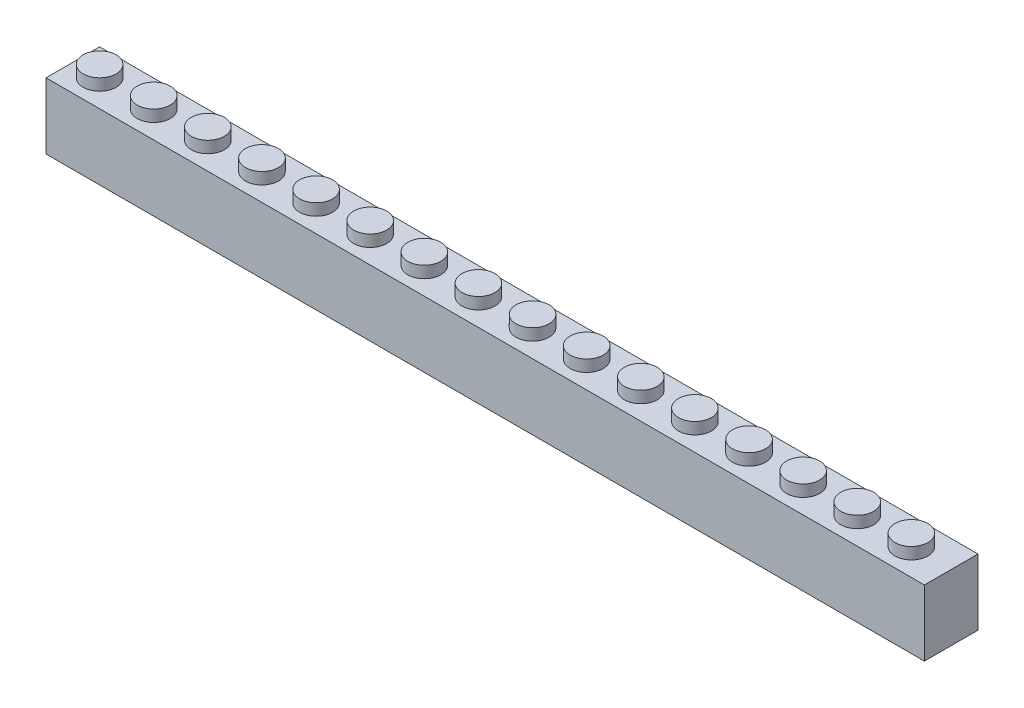
from build123d import *

# Parameters (mm, degrees)
SKETCH_1_W          = 127.8
SKETCH_1_H          = 7.8
EXTRUDE_1_DEPTH     = 9.6
SKETCH_2_R          = 2.4
EXTRUDE_2_DEPTH     = 1.7
SKETCH_3_R          = 2.5
CUT_EXTRUDE_2_DEPTH = 1.8


with BuildPart() as part:
    # Эскиз1 → Бобышка-Вытянуть1 (new body)
    with BuildSketch(Plane(origin=(0, 0, 0), x_dir=(1, 0, 0), z_dir=(0, 1, 0))):
        Rectangle(SKETCH_1_W, SKETCH_1_H)
    extrude(amount=EXTRUDE_1_DEPTH)

    # Эскиз2 → Бобышка-Вытянуть2 (add)
    with BuildSketch(Plane(origin=(0, 9.6, 0), x_dir=(1, 0, 0), z_dir=(0, 1, 0))):
        with Locations(Location((-60, 0, 0), (0, 0, 90))):
            Circle(SKETCH_2_R)
        with Locations(Location((-52.126, 0, 0), (0, 0, 90))):
            Circle(SKETCH_2_R)
        with Locations(Location((-44.252, 0, 0), (0, 0, 90))):
            Circle(SKETCH_2_R)
        with Locations(Location((-36.378, 0, 0), (0, 0, 90))):
            Circle(SKETCH_2_R)
        with Locations(Location((-28.504, 0, 0), (0, 0, 90))):
            Circle(SKETCH_2_R)
        with Locations(Location((-20.63, 0, 0), (0, 0, 90))):
            Circle(SKETCH_2_R)
        with Locations(Location((-12.756, 0, 0), (0, 0, 90))):
            Circle(SKETCH_2_R)
        with Locations(Location((-4.882, 0, 0), (0, 0, 90))):
            Circle(SKETCH_2_R)
        with Locations(Location((2.992, 0, 0), (0, 0, 90))):
            Circle(SKETCH_2_R)
        with Locations(Location((10.866, 0, 0), (0, 0, 90))):
            Circle(SKETCH_2_R)
        with Locations(Location((18.74, 0, 0), (0, 0, 90))):
            Circle(SKETCH_2_R)
        with Locations(Location((26.614, 0, 0), (0, 0, 90))):
            Circle(SKETCH_2_R)
        with Locations(Location((34.488, 0, 0), (0, 0, 90))):
            Circle(SKETCH_2_R)
        with Locations(Location((42.362, 0, 0), (0, 0, 90))):
            Circle(SKETCH_2_R)
        with Locations(Location((50.236, 0, 0), (0, 0, 90))):
            Circle(SKETCH_2_R)
        with Locations(Location((58.11, 0, 0), (0, 0, 90))):
            Circle(SKETCH_2_R)
    extrude(amount=EXTRUDE_2_DEPTH)

    # Эскиз3 → Вырез-Вытянуть2 (cut)
    with BuildSketch(Plane.XZ):
        with Locations(Location((-60, 0, 0), (0, 0, 270))):
            Circle(SKETCH_3_R)
        with Locations(Location((-52.126, 0, 0), (0, 0, 270))):
            Circle(SKETCH_3_R)
        with Locations(Location((-44.252, 0, 0), (0, 0, 270))):
            Circle(SKETCH_3_R)
        with Locations(Location((-36.378, 0, 0), (0, 0, 270))):
            Circle(SKETCH_3_R)
        with Locations(Location((-28.504, 0, 0), (0, 0, 270))):
            Circle(SKETCH_3_R)
        with Locations(Location((-20.63, 0, 0), (0, 0, 270))):
            Circle(SKETCH_3_R)
        with Locations(Location((-12.756, 0, 0), (0, 0, 270))):
            Circle(SKETCH_3_R)
        with Locations(Location((-4.882, 0, 0), (0, 0, 270))):
            Circle(SKETCH_3_R)
        with Locations(Location((2.992, 0, 0), (0, 0, 270))):
            Circle(SKETCH_3_R)
        with Locations(Location((10.866, 0, 0), (0, 0, 270))):
            Circle(SKETCH_3_R)
        with Locations(Location((18.74, 0, 0), (0, 0, 270))):
            Circle(SKETCH_3_R)
        with Locations(Location((26.614, 0, 0), (0, 0, 270))):
            Circle(SKETCH_3_R)
        with Locations(Location((34.488, 0, 0), (0, 0, 270))):
            Circle(SKETCH_3_R)
        with Locations(Location((42.362, 0, 0), (0, 0, 270))):
            Circle(SKETCH_3_R)
        with Locations(Location((50.236, 0, 0), (0, 0, 270))):
            Circle(SKETCH_3_R)
        with Locations(Location((58.11, 0, 0), (0, 0, 270))):
            Circle(SKETCH_3_R)
    extrude(amount=-CUT_EXTRUDE_2_DEPTH, mode=Mode.SUBTRACT)


solid = part.part
